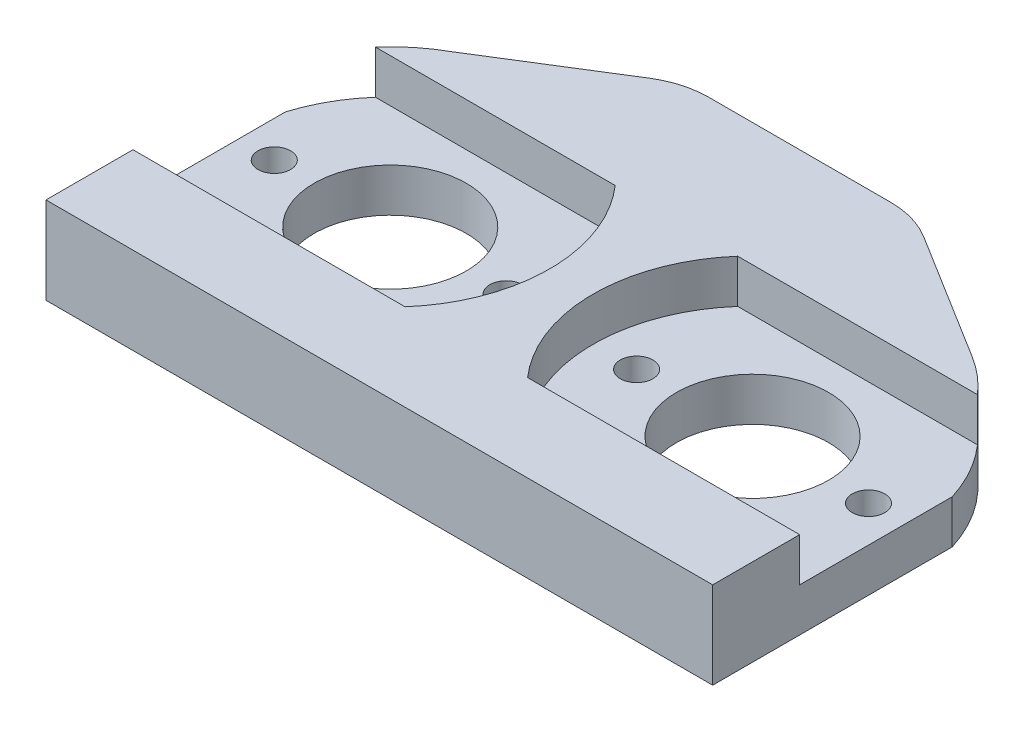
from build123d import *

# Parameters (mm, degrees)
SKETCH1_W           = 92
SKETCH1_H           = 56
BOSS_EXTRUDE1_DEPTH = 12
SKETCH8_W           = 92
SKETCH8_H           = 2
BOSS_EXTRUDE3_DEPTH = 12
CUT_EXTRUDE1_REACH  = 58.214
SKETCH2_R           = 10.5
CUT_EXTRUDE3_DEPTH  = 6
CUT_EXTRUDE4_REACH  = 57.245
SKETCH6_R           = 2.25
CUT_EXTRUDE5_REACH  = 58.214
FILLET2_R           = 12


with BuildPart() as part:
    # Sketch1 → Boss-Extrude1 (new body)
    with BuildSketch(Plane(origin=(0, 0, 0), x_dir=(1, 0, 0), z_dir=(0, 1, 0))):
        Rectangle(SKETCH1_W, SKETCH1_H)
    extrude(amount=BOSS_EXTRUDE1_DEPTH)

    # Sketch8 → Boss-Extrude3 (add)
    with BuildSketch(Plane(origin=(0, 12, 0), x_dir=(1, 0, 0), z_dir=(0, 1, 0))):
        with Locations((0, 29)):
            Rectangle(SKETCH8_W, SKETCH8_H)
    extrude(amount=-BOSS_EXTRUDE3_DEPTH)

    # Sketch2 → Cut-Extrude1 (cut, up to next)
    with BuildSketch(Plane(origin=(0, 12, 0), x_dir=(1, 0, 0), z_dir=(0, 1, 0)), mode=Mode.PRIVATE) as cut_extrude1_sk1:
        with Locations(Location((-25, -1.5, 0), (0, 0, 270))):
            Circle(SKETCH2_R)
    cut_extrude1_tool1 = extrude(cut_extrude1_sk1.sketch, amount=-CUT_EXTRUDE1_REACH, mode=Mode.PRIVATE) & part.part
    # Sketch2 → Cut-Extrude1 (cut, up to next)
    with BuildSketch(Plane(origin=(0, 12, 0), x_dir=(1, 0, 0), z_dir=(0, 1, 0)), mode=Mode.PRIVATE) as cut_extrude1_sk2:
        with Locations(Location((25, -1.5, 0), (0, 0, 270))):
            Circle(SKETCH2_R)
    cut_extrude1_tool2 = extrude(cut_extrude1_sk2.sketch, amount=-CUT_EXTRUDE1_REACH, mode=Mode.PRIVATE) & part.part
    add(cut_extrude1_tool1.solids().sort_by_distance((-25, 12, 1.5))[0], mode=Mode.SUBTRACT)
    add(cut_extrude1_tool2.solids().sort_by_distance((25, 12, 1.5))[0], mode=Mode.SUBTRACT)

    # Sketch5 → Cut-Extrude3 (cut)
    with BuildSketch(Plane(origin=(0, 12, 0), x_dir=(1, 0, 0), z_dir=(0, 1, 0))):
        with BuildLine():
            Line((-46, -16), (-46, -8.057438524))
            ThreePointArc((-46, -8.057438524), (-46.523662477, 3.053235505), (-41.545392108, 13))
            Line((-41.545392108, 13), (-8.454607892, 13))
            ThreePointArc((-8.454607892, 13), (-3, -1.5), (-8.454607892, -16))
            Line((-8.454607892, -16), (-46, -16))
        make_face()
        with BuildLine():
            Line((46, -16), (46, -8.057438524))
            ThreePointArc((46, -8.057438524), (46.523662477, 3.053235505), (41.545392108, 13))
            Line((41.545392108, 13), (8.454607892, 13))
            ThreePointArc((8.454607892, 13), (3, -1.5), (8.454607892, -16))
            Line((8.454607892, -16), (46, -16))
        make_face()
    extrude(amount=-CUT_EXTRUDE3_DEPTH, mode=Mode.SUBTRACT)

    # Sketch6 → Cut-Extrude4 (cut, up to next)
    with BuildSketch(Plane(origin=(0, 6, 0), x_dir=(1, 0, 0), z_dir=(0, 1, 0)), mode=Mode.PRIVATE) as cut_extrude4_sk1:
        with Locations(Location((-41, -1.5, 0), (0, 0, 270))):
            Circle(SKETCH6_R)
    cut_extrude4_tool1 = extrude(cut_extrude4_sk1.sketch, amount=-CUT_EXTRUDE4_REACH, mode=Mode.PRIVATE) & part.part
    # Sketch6 → Cut-Extrude4 (cut, up to next)
    with BuildSketch(Plane(origin=(0, 6, 0), x_dir=(1, 0, 0), z_dir=(0, 1, 0)), mode=Mode.PRIVATE) as cut_extrude4_sk2:
        with Locations(Location((-9, -1.5, 0), (0, 0, 270))):
            Circle(SKETCH6_R)
    cut_extrude4_tool2 = extrude(cut_extrude4_sk2.sketch, amount=-CUT_EXTRUDE4_REACH, mode=Mode.PRIVATE) & part.part
    # Sketch6 → Cut-Extrude4 (cut, up to next)
    with BuildSketch(Plane(origin=(0, 6, 0), x_dir=(1, 0, 0), z_dir=(0, 1, 0)), mode=Mode.PRIVATE) as cut_extrude4_sk3:
        with Locations(Location((9, -1.5, 0), (0, 0, 270))):
            Circle(SKETCH6_R)
    cut_extrude4_tool3 = extrude(cut_extrude4_sk3.sketch, amount=-CUT_EXTRUDE4_REACH, mode=Mode.PRIVATE) & part.part
    # Sketch6 → Cut-Extrude4 (cut, up to next)
    with BuildSketch(Plane(origin=(0, 6, 0), x_dir=(1, 0, 0), z_dir=(0, 1, 0)), mode=Mode.PRIVATE) as cut_extrude4_sk4:
        with Locations(Location((41, -1.5, 0), (0, 0, 270))):
            Circle(SKETCH6_R)
    cut_extrude4_tool4 = extrude(cut_extrude4_sk4.sketch, amount=-CUT_EXTRUDE4_REACH, mode=Mode.PRIVATE) & part.part
    add(cut_extrude4_tool1.solids().sort_by_distance((-41, 6, 1.5))[0], mode=Mode.SUBTRACT)
    add(cut_extrude4_tool2.solids().sort_by_distance((-9, 6, 1.5))[0], mode=Mode.SUBTRACT)
    add(cut_extrude4_tool3.solids().sort_by_distance((9, 6, 1.5))[0], mode=Mode.SUBTRACT)
    add(cut_extrude4_tool4.solids().sort_by_distance((41, 6, 1.5))[0], mode=Mode.SUBTRACT)

    # Sketch10 → Cut-Extrude5 (cut, up to next)
    with BuildSketch(Plane(origin=(0, 12, 0), x_dir=(1, 0, 0), z_dir=(0, 1, 0)), mode=Mode.PRIVATE) as cut_extrude5_sk1:
        with BuildLine():
            Line((-46, 5.057438524), (-46, 30))
            Line((-46, 30), (-16, 30))
            Line((-16, 30), (-35.667304108, 17.740806196))
            ThreePointArc((-35.667304108, 17.740806196), (-42.056420822, 12.395269294), (-46, 5.057438524))
        make_face()
    cut_extrude5_tool1 = extrude(cut_extrude5_sk1.sketch, amount=-CUT_EXTRUDE5_REACH, mode=Mode.PRIVATE) & part.part
    # Sketch10 → Cut-Extrude5 (cut, up to next)
    with BuildSketch(Plane(origin=(0, 12, 0), x_dir=(1, 0, 0), z_dir=(0, 1, 0)), mode=Mode.PRIVATE) as cut_extrude5_sk2:
        with BuildLine():
            Line((46, 5.057438524), (46, 30))
            Line((46, 30), (16, 30))
            Line((16, 30), (36.615382461, 17.183760068))
            ThreePointArc((36.615382461, 17.183760068), (42.39835371, 11.964668142), (46, 5.057438524))
        make_face()
    cut_extrude5_tool2 = extrude(cut_extrude5_sk2.sketch, amount=-CUT_EXTRUDE5_REACH, mode=Mode.PRIVATE) & part.part
    add(cut_extrude5_tool1.solids().sort_by_distance((-36.403407, 12, -23.114901))[0], mode=Mode.SUBTRACT)
    add(cut_extrude5_tool2.solids().sort_by_distance((36.411287, 12, -23.11647))[0], mode=Mode.SUBTRACT)

    # Fillet2
    fillet2_edges = [part.edges().sort_by_distance(p)[0] for p in [
        (-16, 6, -30),
        (16, 6, -30),
    ]]
    fillet(fillet2_edges, radius=FILLET2_R)


solid = part.part
